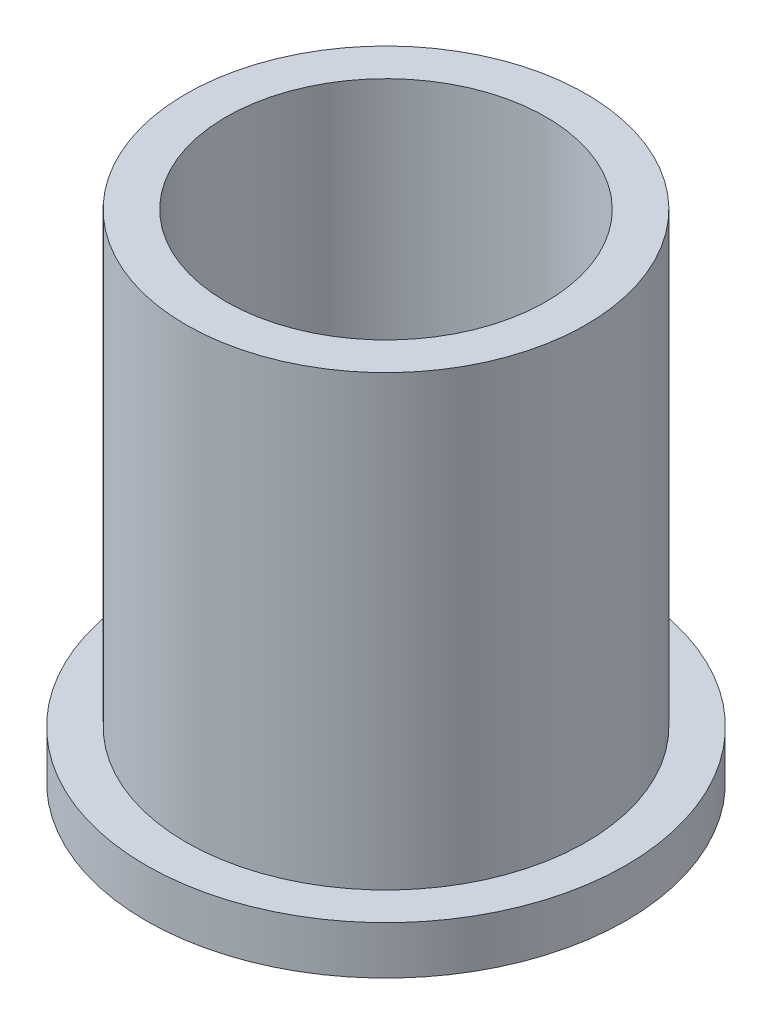
from build123d import *

# Parameters (mm, degrees)
ESBO_O2_R                = 15
ESBO_O2_R_2              = 12.5
RESSALTO_EXTRUS_O1_DEPTH = 3
ESBO_O2_3_R              = 12.5
ESBO_O2_3_R_2            = 10
RESSALTO_EXTRUS_O2_DEPTH = 31


with BuildPart() as part:
    # Esboço2 → Ressalto-extrusão1 (new body)
    with BuildSketch(Plane(origin=(0, 0, 0), x_dir=(1, 0, 0), z_dir=(0, 1, 0))):
        Circle(ESBO_O2_R)
        Circle(ESBO_O2_R_2, mode=Mode.SUBTRACT)
    extrude(amount=RESSALTO_EXTRUS_O1_DEPTH)

    # Esboço2<3> → Ressalto-extrusão2 (add)
    with BuildSketch(Plane(origin=(0, 0, 0), x_dir=(1, 0, 0), z_dir=(0, 1, 0))):
        Circle(ESBO_O2_3_R)
        Circle(ESBO_O2_3_R_2, mode=Mode.SUBTRACT)
    extrude(amount=RESSALTO_EXTRUS_O2_DEPTH)


solid = part.part
